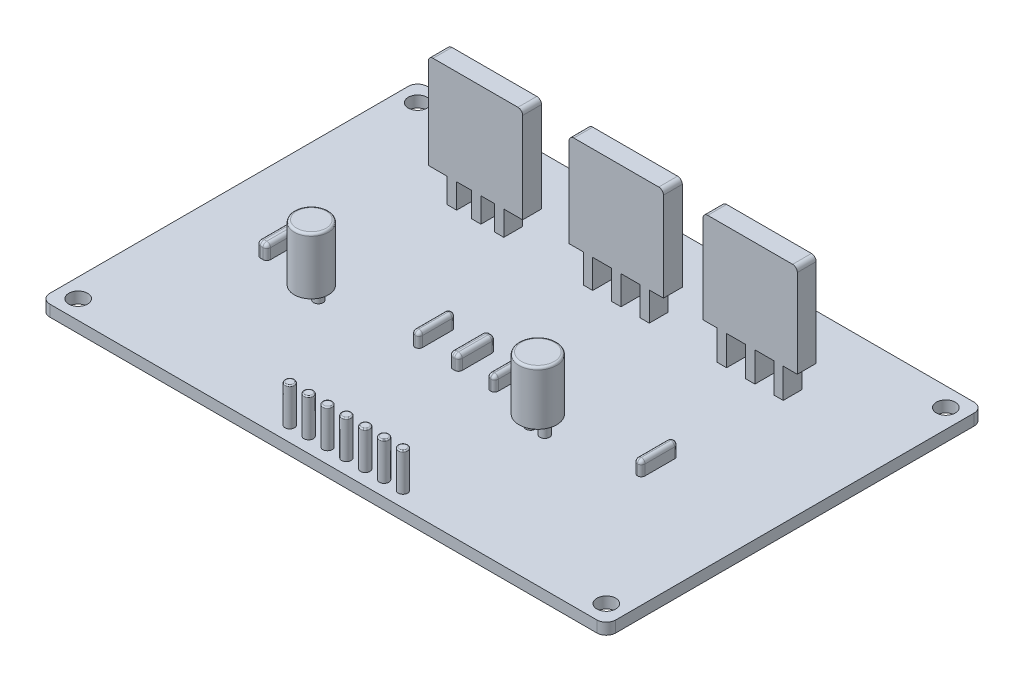
from build123d import *

# Parameters (mm, degrees)
SKETCH2_W            = 60
SKETCH2_H            = 40
BOSS_EXTRUDE1_DEPTH  = 1.2
SKETCH3_R            = 1
CUT_EXTRUDE1_DEPTH   = 2
SKETCH4_W            = 10
SKETCH4_H            = 2
BOSS_EXTRUDE2_DEPTH  = 12.69574079
SKETCH5_W            = 2
SKETCH5_H            = 2.607216684
SKETCH5_W_2          = 1.574700475
SKETCH5_W_3          = 1.425299525
CUT_EXTRUDE2_DEPTH   = 3
SKETCH6_W            = 10
SKETCH6_H            = 2
BOSS_EXTRUDE3_DEPTH  = 13
SKETCH7_W            = 1.5
SKETCH7_H            = 3.045870759
SKETCH7_W_2          = 2
CUT_EXTRUDE3_DEPTH   = 3
SKETCH8_W            = 1.5
SKETCH8_H            = 3.153243881
SKETCH8_W_2          = 2
CUT_EXTRUDE4_DEPTH   = 3
SKETCH9_R            = 0.5
BOSS_EXTRUDE5_DEPTH  = 1
SKETCH10_R           = 1.814545967
BOSS_EXTRUDE6_DEPTH  = 6
SKETCH11_R           = 0.5
BOSS_EXTRUDE7_DEPTH  = 1.5
SKETCH12_R           = 2
BOSS_EXTRUDE9_DEPTH  = 5.7
SKETCH13_R           = 0.5
BOSS_EXTRUDE10_DEPTH = 4
FILLET1_R            = 1
FILLET2_R            = 0.5
FILLET3_R            = 0.25
FILLET4_R            = 0.125
SKETCH14_W           = 0.800980935
SKETCH14_H           = 3.924518692
SKETCH14_W_2         = 1.006338104
SKETCH14_W_3         = 0.836911108
SKETCH14_W_4         = 0.805722202
SKETCH14_W_5         = 1.080198416
BOSS_EXTRUDE11_DEPTH = 1.5
FILLET5_R            = 0.4
FILLET6_R            = 0.4


with BuildPart() as part:
    # Sketch2 → Boss-Extrude1 (new body)
    with BuildSketch(Plane(origin=(0, 0, 0), x_dir=(1, 0, 0), z_dir=(0, 1, 0))):
        Rectangle(SKETCH2_W, SKETCH2_H)
    extrude(amount=BOSS_EXTRUDE1_DEPTH)

    # Sketch3 → Cut-Extrude1 (cut)
    with BuildSketch(Plane(origin=(0, 1.2, 0), x_dir=(1, 0, 0), z_dir=(0, 1, 0))):
        with Locations(Location((-28, -18, 0), (0, 0, 270))):
            Circle(SKETCH3_R)
        with Locations(Location((-28, 18, 0), (0, 0, 270))):
            Circle(SKETCH3_R)
        with Locations(Location((28, 18, 0), (0, 0, 270))):
            Circle(SKETCH3_R)
        with Locations(Location((28, -18, 0), (0, 0, 270))):
            Circle(SKETCH3_R)
    extrude(amount=-CUT_EXTRUDE1_DEPTH, mode=Mode.SUBTRACT)

    # Sketch4 → Boss-Extrude2 (add)
    with BuildSketch(Plane(origin=(0, 1.2, 0), x_dir=(1, 0, 0), z_dir=(0, 1, 0))):
        with Locations((-14.064988864, 11.195743951)):
            Rectangle(SKETCH4_W, SKETCH4_H)
    extrude(amount=BOSS_EXTRUDE2_DEPTH)

    # Sketch5 → Cut-Extrude2 (cut)
    with BuildSketch(Plane.XY.offset(-10.195743951)):
        with Locations((-18.064988864, 2.503608342)):
            Rectangle(SKETCH5_W, SKETCH5_H)
        with Locations((-10.064988864, 2.503608342)):
            Rectangle(SKETCH5_W, SKETCH5_H)
        with Locations((-15.277638626, 2.503608342)):
            Rectangle(SKETCH5_W_2, SKETCH5_H)
        with Locations((-12.777638626, 2.503608342)):
            Rectangle(SKETCH5_W_3, SKETCH5_H)
    extrude(amount=-CUT_EXTRUDE2_DEPTH, mode=Mode.SUBTRACT)

    # Sketch6 → Boss-Extrude3 (add)
    with BuildSketch(Plane(origin=(0, 1.2, 0), x_dir=(1, 0, 0), z_dir=(0, 1, 0))):
        with Locations((1.024873768, 11.033307635)):
            Rectangle(SKETCH6_W, SKETCH6_H)
        with Locations((15.221753168, 11.033307635)):
            Rectangle(SKETCH6_W, SKETCH6_H)
    extrude(amount=BOSS_EXTRUDE3_DEPTH)

    # Sketch7 → Cut-Extrude3 (cut)
    with BuildSketch(Plane.XY.offset(-10.033307635)):
        with Locations((-3.225126232, 2.72293538)):
            Rectangle(SKETCH7_W, SKETCH7_H)
        with Locations((5.274873768, 2.72293538)):
            Rectangle(SKETCH7_W, SKETCH7_H)
        with Locations((-0.475126232, 2.72293538)):
            Rectangle(SKETCH7_W_2, SKETCH7_H)
        with Locations((2.524873768, 2.72293538)):
            Rectangle(SKETCH7_W_2, SKETCH7_H)
    extrude(amount=-CUT_EXTRUDE3_DEPTH, mode=Mode.SUBTRACT)

    # Sketch8 → Cut-Extrude4 (cut)
    with BuildSketch(Plane.XY.offset(-10.033307635)):
        with Locations((10.971753168, 2.776621941)):
            Rectangle(SKETCH8_W, SKETCH8_H)
        with Locations((19.471753168, 2.776621941)):
            Rectangle(SKETCH8_W, SKETCH8_H)
        with Locations((16.721753168, 2.776621941)):
            Rectangle(SKETCH8_W_2, SKETCH8_H)
        with Locations((13.721753168, 2.776621941)):
            Rectangle(SKETCH8_W_2, SKETCH8_H)
    extrude(amount=-CUT_EXTRUDE4_DEPTH, mode=Mode.SUBTRACT)

    # Sketch9 → Boss-Extrude5 (add)
    with BuildSketch(Plane(origin=(0, 1.2, 0), x_dir=(1, 0, 0), z_dir=(0, 1, 0))):
        with Locations(Location((-16.64570554, -5.388190515, 0), (0, 0, 90))):
            Circle(SKETCH9_R)
        with Locations(Location((-15.14570554, -5.388190515, 0), (0, 0, 90))):
            Circle(SKETCH9_R)
    extrude(amount=BOSS_EXTRUDE5_DEPTH)

    # Sketch10 → Boss-Extrude6 (add)
    with BuildSketch(Plane(origin=(0, 2.2, 0), x_dir=(1, 0, 0), z_dir=(0, 1, 0))):
        with Locations(Location((-15.895664673, -5.377177987, 0), (0, 0, 270))):
            Circle(SKETCH10_R)
    extrude(amount=BOSS_EXTRUDE6_DEPTH)

    # Sketch11 → Boss-Extrude7 (add)
    with BuildSketch(Plane(origin=(0, 1.2, 0), x_dir=(1, 0, 0), z_dir=(0, 1, 0))):
        with Locations(Location((7.719899119, -5.747410751, 0), (0, 0, 90))):
            Circle(SKETCH11_R)
        with Locations(Location((9.219899119, -5.747410751, 0), (0, 0, 90))):
            Circle(SKETCH11_R)
    extrude(amount=BOSS_EXTRUDE7_DEPTH)

    # Sketch12 → Boss-Extrude9 (add)
    with BuildSketch(Plane(origin=(0, 2.7, 0), x_dir=(1, 0, 0), z_dir=(0, 1, 0))):
        with Locations(Location((8.453559057, -5.714453729, 0), (0, 0, 270))):
            Circle(SKETCH12_R)
    extrude(amount=BOSS_EXTRUDE9_DEPTH)

    # Sketch13 → Boss-Extrude10 (add)
    with BuildSketch(Plane(origin=(0, 1.2, 0), x_dir=(1, 0, 0), z_dir=(0, 1, 0))):
        with Locations(Location((-5.169756881, -18.391564272, 0), (0, 0, 90))):
            Circle(SKETCH13_R)
        with Locations(Location((-3.169756881, -18.391564272, 0), (0, 0, 90))):
            Circle(SKETCH13_R)
        with Locations(Location((-1.169756881, -18.391564272, 0), (0, 0, 90))):
            Circle(SKETCH13_R)
        with Locations(Location((0.830243119, -18.391564272, 0), (0, 0, 90))):
            Circle(SKETCH13_R)
        with Locations(Location((2.830243119, -18.391564272, 0), (0, 0, 90))):
            Circle(SKETCH13_R)
        with Locations(Location((4.830243119, -18.391564272, 0), (0, 0, 90))):
            Circle(SKETCH13_R)
        with Locations(Location((6.830243119, -18.391564272, 0), (0, 0, 90))):
            Circle(SKETCH13_R)
    extrude(amount=BOSS_EXTRUDE10_DEPTH)

    # Fillet1
    fillet1_edges = [part.edges().sort_by_distance(p)[0] for p in [
        (30, 0.6, 20),
        (-30, 0.6, 20),
        (-30, 0.6, -20),
        (30, 0.6, -20),
    ]]
    fillet(fillet1_edges, radius=FILLET1_R)

    # Fillet2
    fillet2_edges = [part.edges().sort_by_distance(p)[0] for p in [
        (10.221753168, 14.2, -11.033307635),
        (20.221753168, 14.2, -11.033307635),
        (-3.975126232, 14.2, -11.033307635),
        (6.024873768, 14.2, -11.033307635),
        (-9.064988864, 13.89574079, -11.195743951),
        (-19.064988864, 13.89574079, -11.195743951),
    ]]
    fillet(fillet2_edges, radius=FILLET2_R)

    # Fillet3
    fillet3_edges = [part.edges().sort_by_distance(p)[0] for p in [
        (-15.895664673, 8.2, 3.56263202),
        (8.453559057, 8.4, 3.714453729),
    ]]
    fillet(fillet3_edges, radius=FILLET3_R)

    # Fillet4
    fillet4_edges = [part.edges().sort_by_distance(p)[0] for p in [
        (-5.169756881, 5.2, 18.891564272),
        (-3.169756881, 5.2, 18.891564272),
        (-1.169756881, 5.2, 18.891564272),
        (0.830243119, 5.2, 18.891564272),
        (2.830243119, 5.2, 18.891564272),
        (4.830243119, 5.2, 18.891564272),
        (6.830243119, 5.2, 18.891564272),
    ]]
    fillet(fillet4_edges, radius=FILLET4_R)

    # Sketch14 → Boss-Extrude11 (add)
    with BuildSketch(Plane(origin=(0, 1.2, 0), x_dir=(1, 0, 0), z_dir=(0, 1, 0))):
        with Locations((-5.658632568, -2.656260968)):
            Rectangle(SKETCH14_W, SKETCH14_H)
        with Locations((-1.552601189, -2.656260968)):
            Rectangle(SKETCH14_W_2, SKETCH14_H)
        with Locations((2.351814304, -2.656260968)):
            Rectangle(SKETCH14_W_3, SKETCH14_H)
        with Locations((17.927434185, -2.656260968)):
            Rectangle(SKETCH14_W_4, SKETCH14_H)
        with Locations((-21.924184268, -2.656260968)):
            Rectangle(SKETCH14_W_5, SKETCH14_H)
    extrude(amount=BOSS_EXTRUDE11_DEPTH)

    # Fillet5
    fillet5_edges = [part.edges().sort_by_distance(p)[0] for p in [
        (17.524573084, 1.95, 0.694001622),
        (17.524573084, 1.95, 4.618520314),
        (18.330295286, 1.95, 4.618520314),
        (18.330295286, 1.95, 0.694001622),
        (17.524573084, 2.7, 2.656260968),
        (17.927434185, 2.7, 4.618520314),
        (18.330295286, 2.7, 2.656260968),
        (17.927434185, 2.7, 0.694001622),
    ]]
    fillet(fillet5_edges, radius=FILLET5_R)

    # Fillet6
    fillet6_edges = [part.edges().sort_by_distance(p)[0] for p in [
        (-6.059123035, 1.95, 0.694001622),
        (-6.059123035, 1.95, 4.618520314),
        (-5.2581421, 1.95, 4.618520314),
        (-5.2581421, 1.95, 0.694001622),
        (-6.059123035, 2.7, 2.656260968),
        (-5.658632567, 2.7, 4.618520314),
        (-5.2581421, 2.7, 2.656260968),
        (-5.658632567, 2.7, 0.694001622),
        (-2.055770241, 1.95, 0.694001622),
        (-2.055770241, 1.95, 4.618520314),
        (-1.049432137, 1.95, 4.618520314),
        (-1.049432137, 1.95, 0.694001622),
        (-2.055770241, 2.7, 2.656260968),
        (-1.552601189, 2.7, 4.618520314),
        (-1.049432137, 2.7, 2.656260968),
        (-1.552601189, 2.7, 0.694001622),
        (1.93335875, 1.95, 0.694001622),
        (1.93335875, 1.95, 4.618520314),
        (2.770269858, 1.95, 4.618520314),
        (2.770269858, 1.95, 0.694001622),
        (1.93335875, 2.7, 2.656260968),
        (2.351814304, 2.7, 4.618520314),
        (2.770269858, 2.7, 2.656260968),
        (2.351814304, 2.7, 0.694001622),
        (-22.464283476, 1.95, 0.694001622),
        (-22.464283476, 1.95, 4.618520314),
        (-21.38408506, 1.95, 4.618520314),
        (-21.38408506, 1.95, 0.694001622),
        (-22.464283476, 2.7, 2.656260968),
        (-21.924184268, 2.7, 4.618520314),
        (-21.38408506, 2.7, 2.656260968),
        (-21.924184268, 2.7, 0.694001622),
    ]]
    fillet(fillet6_edges, radius=FILLET6_R)


solid = part.part
